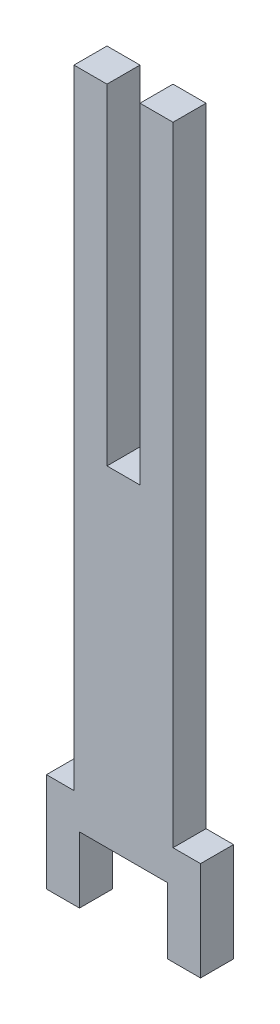
from build123d import *

# Parameters (mm, degrees)
EXTRUDE_1_DEPTH     = 3
SKETCH_2_W          = 3
SKETCH_2_H          = 30.044
CUT_EXTRUDE_1_DEPTH = 3


with BuildPart() as part:
    # 스케치1 → 보스-돌출1 (new body)
    with BuildSketch(Plane.XY):
        Polygon((-4.5, 33.044), (4.5, 33.044), (4.5, -24.044), (7, -24.044), (7, -33.044), (4, -33.044), (4, -27.044), (-4, -27.044), (-4, -33.044), (-7, -33.044), (-7, -24.044), (-4.5, -24.044), align=None)
    extrude(amount=EXTRUDE_1_DEPTH)

    # 스케치2 → 컷-돌출1 (cut)
    with BuildSketch(Plane.XY.offset(3)):
        with Locations((0, 18.022)):
            Rectangle(SKETCH_2_W, SKETCH_2_H)
    extrude(amount=-CUT_EXTRUDE_1_DEPTH, mode=Mode.SUBTRACT)


solid = part.part
